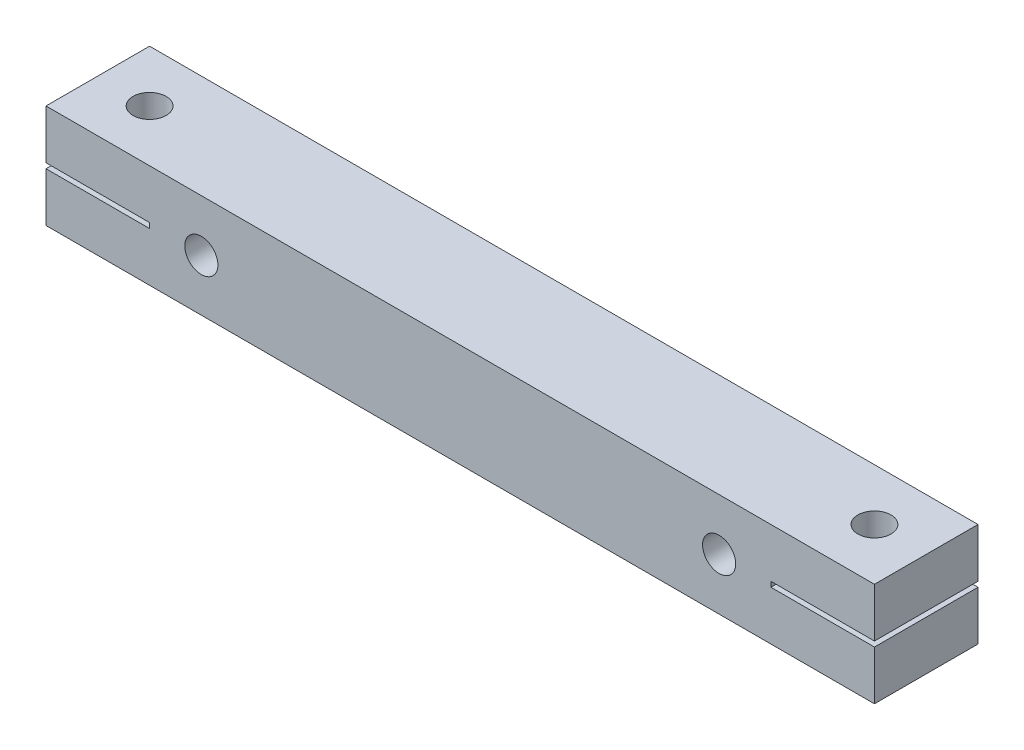
from build123d import *

# Parameters (mm, degrees)
SKETCH1_W           = 80
SKETCH1_H           = 10
BOSS_EXTRUDE1_DEPTH = 5
SKETCH2_W           = 10
SKETCH2_H           = 0.5
CUT_EXTRUDE1_DEPTH  = 81.777472107
SKETCH3_R           = 1.6
CUT_EXTRUDE2_DEPTH  = 81.777472107
SKETCH5_R           = 1.6
CUT_EXTRUDE3_DEPTH  = 81.777472107


with BuildPart() as part:
    # Sketch1 → Boss-Extrude1 (new, symmetric)
    with BuildSketch(Plane.XY):
        with Locations((40, 0)):
            Rectangle(SKETCH1_W, SKETCH1_H)
    extrude(amount=BOSS_EXTRUDE1_DEPTH, both=True)

    # Sketch2 → Cut-Extrude1 (cut, through all)
    with BuildSketch(Plane.XY.offset(5)):
        with Locations((5, 0)):
            Rectangle(SKETCH2_W, SKETCH2_H)
        with Locations((75, 0)):
            Rectangle(SKETCH2_W, SKETCH2_H)
    extrude(amount=-CUT_EXTRUDE1_DEPTH, mode=Mode.SUBTRACT)

    # Sketch3 → Cut-Extrude2 (cut, through all)
    with BuildSketch(Plane(origin=(0, 5, 0), x_dir=(1, 0, 0), z_dir=(0, 1, 0))):
        with Locations(Location((5, 0, 0), (0, 0, 180))):
            Circle(SKETCH3_R)
        with Locations(Location((75, 0, 0), (0, 0, 180))):
            Circle(SKETCH3_R)
    extrude(amount=-CUT_EXTRUDE2_DEPTH, mode=Mode.SUBTRACT)

    # Sketch5 → Cut-Extrude3 (cut, through all)
    with BuildSketch(Plane.XY.offset(5)):
        with Locations((15, 0)):
            Circle(SKETCH5_R)
        with Locations((65, 0)):
            Circle(SKETCH5_R)
    extrude(amount=-CUT_EXTRUDE3_DEPTH, mode=Mode.SUBTRACT)


solid = part.part
